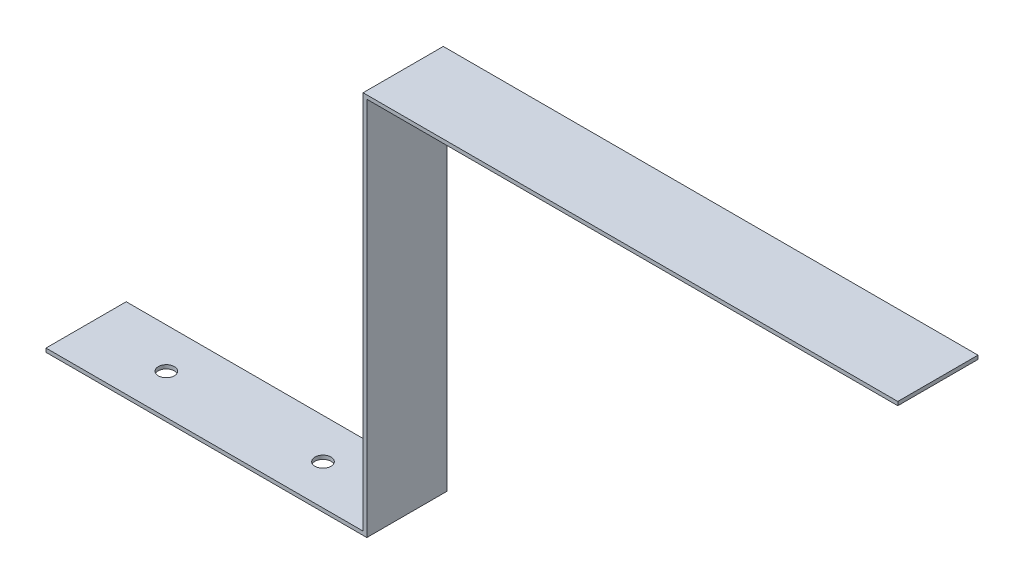
from build123d import *

# Parameters (mm, degrees)
BOSS_EXTRUDE1_DEPTH = 15
SKETCH2_R           = 1.5
CUT_EXTRUDE1_DEPTH  = 176.049964296


with BuildPart() as part:
    # Sketch1 → Boss-Extrude1 (new body)
    with BuildSketch(Plane.XY):
        Polygon((0, 0), (60, 0), (60, 71), (159.3, 71), (159.3, 71.7), (59.3, 71.7), (59.3, 0.7), (0, 0.7), align=None)
    extrude(amount=BOSS_EXTRUDE1_DEPTH)

    # Sketch2 → Cut-Extrude1 (cut, through all)
    with BuildSketch(Plane(origin=(0, 0.7, 0), x_dir=(1, 0, 0), z_dir=(0, 1, 0))):
        with Locations(Location((15, -7.5, 0), (0, 0, 180))):
            Circle(SKETCH2_R)
        with Locations(Location((44.3, -7.5, 0), (0, 0, 180))):
            Circle(SKETCH2_R)
    extrude(amount=-CUT_EXTRUDE1_DEPTH, mode=Mode.SUBTRACT)


solid = part.part
